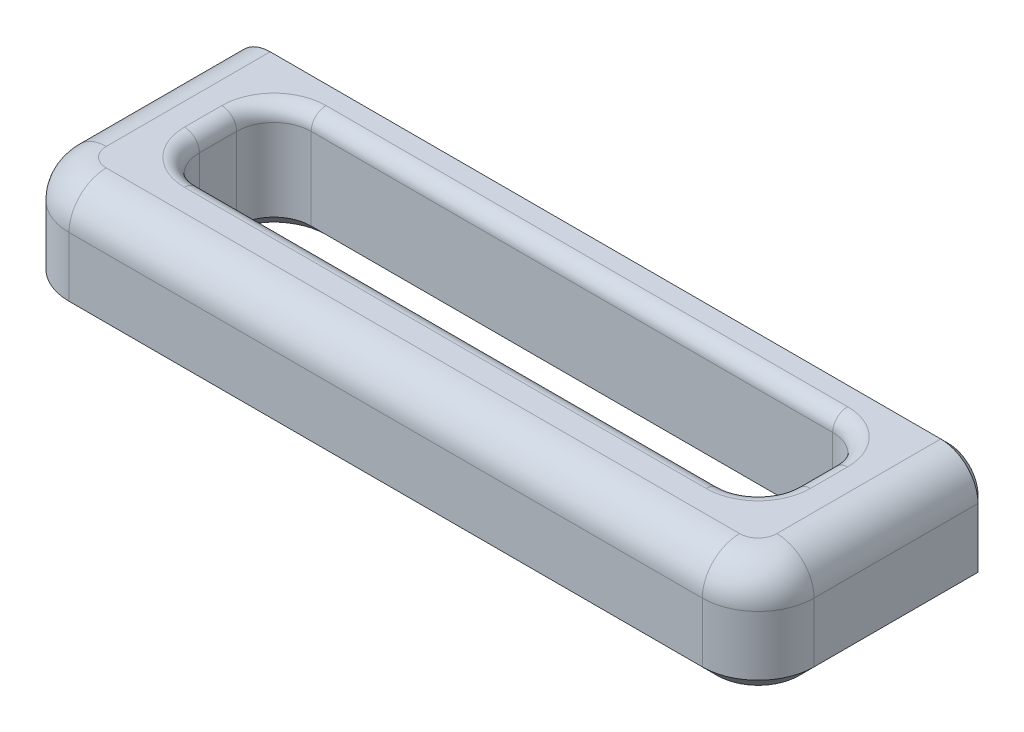
from build123d import *

# Parameters (mm, degrees)
SKETCH_1_W          = 20
SKETCH_1_H          = 6.1
EXTRUDE_1_DEPTH     = 3
SKETCH_2_W          = 16
SKETCH_2_H          = 3
CUT_EXTRUDE_1_DEPTH = 3
FILLET_1_R          = 1
FILLET_2_R          = 1.5
FILLET_3_R          = 1
CHAMFER_1_SIZE      = 0.4
FILLET_4_R          = 0.4
CHAMFER_2_SIZE      = 0.2


with BuildPart() as part:
    # 草图1 → 凸台-拉伸1 (new body)
    with BuildSketch(Plane(origin=(0, 0, 0), x_dir=(1, 0, 0), z_dir=(0, 1, 0))):
        with Locations((10, 3.05)):
            Rectangle(SKETCH_1_W, SKETCH_1_H)
    extrude(amount=EXTRUDE_1_DEPTH)

    # 草图2 → 切除-拉伸1 (cut)
    with BuildSketch(Plane(origin=(0, 3, 0), x_dir=(1, 0, 0), z_dir=(0, 1, 0))):
        with Locations((10, 3.5)):
            Rectangle(SKETCH_2_W, SKETCH_2_H)
    extrude(amount=-CUT_EXTRUDE_1_DEPTH, mode=Mode.SUBTRACT)

    # 圆角1
    fillet_1_edges = [part.edges().sort_by_distance(p)[0] for p in [
        (2, 1.5, -2),
        (2, 1.5, -5),
        (18, 1.5, -5),
        (18, 1.5, -2),
    ]]
    fillet(fillet_1_edges, radius=FILLET_1_R)

    # 圆角2
    fillet_2_edges = [part.edges().sort_by_distance(p)[0] for p in [
        (20, 1.5, 0),
        (0, 1.5, 0),
    ]]
    fillet(fillet_2_edges, radius=FILLET_2_R)

    # 圆角3
    fillet_3_edges = [part.edges().sort_by_distance(p)[0] for p in [
        (0, 3, -3.8),
        (10, 3, 0),
        (20, 3, -3.8),
        (19.560660172, 3, -0.439339828),
        (0.439339828, 3, -0.439339828),
    ]]
    fillet(fillet_3_edges, radius=FILLET_3_R)

    # 倒角1
    chamfer_1_edges = [part.edges().sort_by_distance(p)[0] for p in [
        (2, 0, -3.5),
        (10, 0, -5),
        (18, 0, -3.5),
        (10, 0, -2),
        (2.292893219, 0, -4.707106781),
        (17.707106781, 0, -4.707106781),
        (17.707106781, 0, -2.292893219),
        (2.292893219, 0, -2.292893219),
        (10, 0, 0),
        (20, 0, -3.8),
        (19.560660172, 0, -0.439339828),
        (0.439339828, 0, -0.439339828),
        (0, 0, -3.8),
    ]]
    chamfer(chamfer_1_edges, length=CHAMFER_1_SIZE)

    # 圆角4
    fillet_4_edges = [part.edges().sort_by_distance(p)[0] for p in [
        (2, 3, -3.5),
        (10, 3, -5),
        (18, 3, -3.5),
        (10, 3, -2),
        (2.292893219, 3, -4.707106781),
        (17.707106781, 3, -4.707106781),
        (17.707106781, 3, -2.292893219),
        (2.292893219, 3, -2.292893219),
    ]]
    fillet(fillet_4_edges, radius=FILLET_4_R)

    # 倒角2
    chamfer_2_edges = [part.edges().sort_by_distance(p)[0] for p in [
        (19.8, 0.2, -6.1),
        (0.2, 0.2, -6.1),
        (10, 3, -6.1),
        (0, 1.2, -6.1),
        (20, 1.2, -6.1),
        (19.707106781, 2.707106781, -6.1),
        (0.292893219, 2.707106781, -6.1),
        (10, 0, -6.1),
    ]]
    chamfer(chamfer_2_edges, length=CHAMFER_2_SIZE)


solid = part.part
